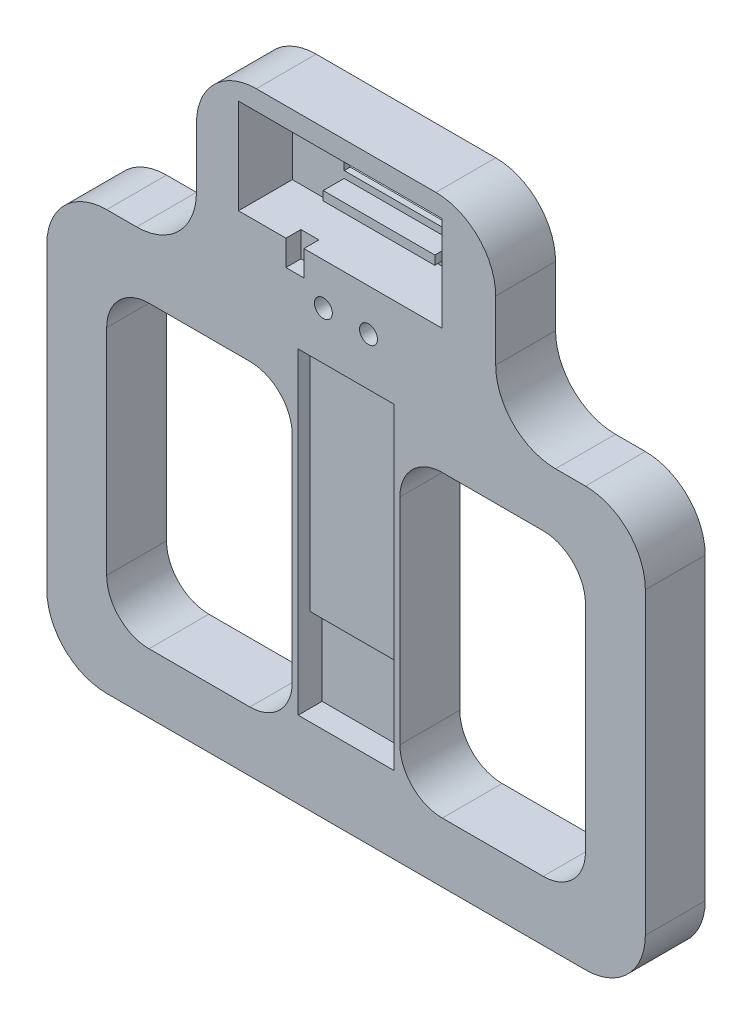
from build123d import *

# Parameters (mm, degrees)
IZIM1_W                      = 200
IZIM1_H                      = 230
Y_KSEKLIK_EKSTR_ZYON1_DEPTH  = 20
KES_EKSTR_ZYON11_DEPTH       = 75
IZIM4_W                      = 100
IZIM4_H                      = 230
KES_EKSTR_ZYON12_DEPTH       = 90
IZIM10_W                     = 32
IZIM10_H                     = 136
Y_KSEKLIK_EKSTR_ZYON6_DEPTH  = 20
KES_EKSTR_ZYON15_DEPTH       = 222
KES_EKSTR_ZYON15_DEPTH_BACK  = 26
Y_KSEKLIK_EKSTR_ZYON7_DEPTH  = 20
IZIM16_W                     = 37.3
IZIM16_H                     = 17
KES_EKSTR_ZYON16_DEPTH       = 20
KES_EKSTR_ZYON20_DEPTH       = 42
KES_EKSTR_ZYON21_DEPTH       = 42
IZIM20_W                     = 71.9
IZIM20_H                     = 2
KES_EKSTR_ZYON22_DEPTH       = 42
IZIM21_R                     = 1.5
Y_KSEKLIK_EKSTR_ZYON8_DEPTH  = 15
IZIM22_W                     = 3
IZIM22_H                     = 3
Y_KSEKLIK_EKSTR_ZYON9_DEPTH  = 8
IZIM23_W                     = 71.9
IZIM23_H                     = 36
Y_KSEKLIK_EKSTR_ZYON10_DEPTH = 1
KES_EKSTR_ZYON23_DEPTH       = 56
KES_EKSTR_ZYON23_DEPTH_BACK  = 86
IZIM24_W                     = 37.3
IZIM24_H                     = 17
IZIM26_W                     = 3
IZIM26_H                     = 3
Y_KSEKLIK_EKSTR_ZYON11_DEPTH = 8
IZIM27_W                     = 71.9
IZIM27_H                     = 2.056938391
Y_KSEKLIK_EKSTR_ZYON13_DEPTH = 19
Y_KSEKLIK_EKSTR_ZYON16_DEPTH = 19
IZIM31_W                     = 3
IZIM31_H                     = 3
Y_KSEKLIK_EKSTR_ZYON18_DEPTH = 8
IZIM32_R                     = 1.5
KES_EKSTR_ZYON24_DEPTH       = 32
IZIM33_R                     = 1.5
Y_KSEKLIK_EKSTR_ZYON19_DEPTH = 12
KES_EKSTR_ZYON27_DEPTH       = 1
KES_EKSTR_ZYON27_DEPTH_BACK  = 3
IZIM37_R                     = 2.5
KES_EKSTR_ZYON28_DEPTH       = 33
IZIM38_W                     = 34
IZIM38_H                     = 110
KES_EKSTR_ZYON33_DEPTH       = 42
IZIM40_W                     = 34
IZIM40_H                     = 110
Y_KSEKLIK_EKSTR_ZYON21_DEPTH = 15
IZIM41_W                     = 4
IZIM41_H                     = 8.5
KES_EKSTR_ZYON35_DEPTH       = 21
IZIM44_W                     = 4
IZIM44_H                     = 8.5
Y_KSEKLIK_EKSTR_ZYON23_DEPTH = 14
IZIM45_W                     = 1
IZIM45_H                     = 110
Y_KSEKLIK_EKSTR_ZYON25_DEPTH = 19
IZIM46_W                     = 12.0691428
IZIM46_H                     = 4.443061609
IZIM46_W_2                   = 12.8
Y_KSEKLIK_EKSTR_ZYON27_DEPTH = 8
IZIM47_W                     = 37.3
IZIM47_H                     = 3
Y_KSEKLIK_EKSTR_ZYON28_DEPTH = 8
KES_EKSTR_ZYON36_DEPTH       = 10
KES_EKSTR_ZYON36_DEPTH_BACK  = 38
IZIM48_W                     = 201.789222688
IZIM48_H                     = 30
KES_EKSTR_ZYON37_DEPTH       = 38
KES_EKSTR_ZYON37_DEPTH_BACK  = 38
KES_EKSTR_ZYON38_DEPTH       = 38
KES_EKSTR_ZYON38_DEPTH_BACK  = 38
SKETCH1_W                    = 32
SKETCH1_H                    = 28
CUT_EXTRUDE1_DEPTH           = 55
SKETCH2_W                    = 32
SKETCH2_H                    = 28
BOSS_EXTRUDE1_DEPTH          = 11
SKETCH3_W                    = 32
SKETCH3_H                    = 4
BOSS_EXTRUDE2_DEPTH          = 19
SKETCH4_W                    = 37.3
SKETCH4_H                    = 0.358806935
CUT_EXTRUDE3_DEPTH           = 11
SKETCH5_W                    = 37.3
SKETCH5_H                    = 0.35880693
BOSS_EXTRUDE3_DEPTH          = 9
SKETCH6_W                    = 37.3
SKETCH6_H                    = 0.358806935
BOSS_EXTRUDE4_DEPTH          = 2
SKETCH7_W                    = 6
SKETCH7_H                    = 8.5
CUT_EXTRUDE4_DEPTH           = 20
SKETCH8_W                    = 6
SKETCH8_H                    = 8.5
BOSS_EXTRUDE5_DEPTH          = 15
SKETCH9_R                    = 3
CUT_EXTRUDE5_DEPTH           = 27
SKETCH10_W                   = 12.0691428
SKETCH10_H                   = 4.443061609
CUT_EXTRUDE8_DEPTH           = 20
SKETCH11_W                   = 12.8
SKETCH11_H                   = 4.443061609
CUT_EXTRUDE9_DEPTH           = 22
SKETCH12_W                   = 12.0691428
SKETCH12_H                   = 4.443061609
SKETCH12_W_2                 = 12.8
BOSS_EXTRUDE6_DEPTH          = 9
CUT_EXTRUDE10_DEPTH          = 37
SKETCH14_R                   = 5
CUT_EXTRUDE11_DEPTH          = 5


with BuildPart() as part:
    # Çizim1 → Yükseklik-Ekstrüzyon1 (new body)
    with BuildSketch(Plane.XY):
        with Locations((54.847725907, 89.085138461)):
            Rectangle(IZIM1_W, IZIM1_H)
    extrude(amount=Y_KSEKLIK_EKSTR_ZYON1_DEPTH)

    # Çizim2 → Kes-Ekstrüzyon11 (cut)
    with BuildSketch(Plane.XY):
        with BuildLine():
            Line((4.847725907, 164.085138461), (4.847725907, 184.085138461))
            ThreePointArc((4.847725907, 184.085138461), (10.705590284, 198.227274085), (24.847725907, 204.085138461))
            Line((24.847725907, 204.085138461), (-45.152274093, 204.085138461))
            Line((-45.152274093, 204.085138461), (-45.152274093, 124.085138461))
            ThreePointArc((-45.152274093, 124.085138461), (-39.294409716, 138.227274085), (-25.152274093, 144.085138461))
            Line((-25.152274093, 144.085138461), (-15.152274093, 144.085138461))
            ThreePointArc((-15.152274093, 144.085138461), (-1.010138469, 149.943002837), (4.847725907, 164.085138461))
        make_face()
        with BuildLine():
            Line((-45.152274093, -25.914861539), (-25.152274093, -25.914861539))
            ThreePointArc((-25.152274093, -25.914861539), (-39.294409716, -20.056997163), (-45.152274093, -5.914861539))
            Line((-45.152274093, -5.914861539), (-45.152274093, -25.914861539))
        make_face()
    extrude(amount=KES_EKSTR_ZYON11_DEPTH, mode=Mode.SUBTRACT)

    # Çizim4 → Kes-Ekstrüzyon12 (cut)
    with BuildSketch(Plane.XY):
        with Locations((104.847725907, 89.085138461)):
            Rectangle(IZIM4_W, IZIM4_H)
    extrude(amount=KES_EKSTR_ZYON12_DEPTH, mode=Mode.SUBTRACT)

    # Aynalama35: part across plane


with BuildPart() as part_1:
    add(part.part)
    add(part.part.mirror(Plane(origin=(54.847725907, 0, 90), x_dir=(0, 0, 1), z_dir=(-1, 0, 0))))

    # Çizim10 → Yükseklik-Ekstrüzyon6 (add)
    with BuildSketch(Plane.XY):
        Polygon((38.847725907, 129.085138461), (72.847725907, 129.085138461), (72.847725907, -10.914861539), (36.847725907, -10.914861539), (36.847725907, 129.085138461), align=None)
        with Locations((54.847725907, 59.085138461)):
            Rectangle(IZIM10_W, IZIM10_H, mode=Mode.SUBTRACT)
    extrude(amount=-Y_KSEKLIK_EKSTR_ZYON6_DEPTH)

    # Çizim11 → Kes-Ekstrüzyon15 (cut, two sides: drawn at the far end of the back side and taken through both)
    with BuildSketch(Plane(origin=(0, 0, 0), x_dir=(0, 0, -1), z_dir=(1, 0, 0)).offset(-KES_EKSTR_ZYON15_DEPTH_BACK)):
        Polygon((20, -10.914861539), (14, -10.914861539), (20, 129.085138461), align=None)
    extrude(amount=KES_EKSTR_ZYON15_DEPTH + KES_EKSTR_ZYON15_DEPTH_BACK, mode=Mode.SUBTRACT)

    # Çizim15 → Yükseklik-Ekstrüzyon7 (add)
    with BuildSketch(Plane.XY):
        with BuildLine():
            Line((-45.152274093, 124.085138461), (-45.152274093, -5.914861539))
            ThreePointArc((-45.152274093, -5.914861539), (-39.294409716, -20.056997163), (-25.152274093, -25.914861539))
            Line((-25.152274093, -25.914861539), (134.847725907, -25.914861539))
            ThreePointArc((134.847725907, -25.914861539), (148.989861531, -20.056997163), (154.847725907, -5.914861539))
            Line((154.847725907, -5.914861539), (154.847725907, 124.085138461))
            ThreePointArc((154.847725907, 124.085138461), (148.989861531, 138.227274085), (134.847725907, 144.085138461))
            Line((134.847725907, 144.085138461), (124.847725907, 144.085138461))
            ThreePointArc((124.847725907, 144.085138461), (110.705590284, 149.943002837), (104.847725907, 164.085138461))
            Line((104.847725907, 164.085138461), (104.847725907, 184.085138461))
            ThreePointArc((104.847725907, 184.085138461), (98.989861531, 198.227274085), (84.847725907, 204.085138461))
            Line((84.847725907, 204.085138461), (24.847725907, 204.085138461))
            ThreePointArc((24.847725907, 204.085138461), (10.705590284, 198.227274085), (4.847725907, 184.085138461))
            Line((4.847725907, 184.085138461), (4.847725907, 164.085138461))
            ThreePointArc((4.847725907, 164.085138461), (-1.010138469, 149.943002837), (-15.152274093, 144.085138461))
            Line((-15.152274093, 144.085138461), (-25.152274093, 144.085138461))
            ThreePointArc((-25.152274093, 144.085138461), (-39.294409716, 138.227274085), (-45.152274093, 124.085138461))
        make_face()
    extrude(amount=Y_KSEKLIK_EKSTR_ZYON7_DEPTH)

    # Çizim16 → Kes-Ekstrüzyon16 (cut)
    with BuildSketch(Plane.XY):
        with Locations((54.847725907, 185.585138461)):
            Rectangle(IZIM16_W, IZIM16_H)
    extrude(amount=KES_EKSTR_ZYON16_DEPTH, mode=Mode.SUBTRACT)

    # Çizim18 → Kes-Ekstrüzyon20 (cut)
    with BuildSketch(Plane(origin=(0, 0, 1), x_dir=(-1, 0, 0), z_dir=(0, 0, -1))):
        Polygon((-90.797725907, 197.585138461), (-90.797725907, 185.585138461), (-90.797725907, 163.585138461), (-18.897725907, 163.585138461), (-18.897725907, 197.585138461), align=None)
    extrude(amount=-KES_EKSTR_ZYON20_DEPTH, mode=Mode.SUBTRACT)

    # Çizim19 → Kes-Ekstrüzyon21 (cut)
    with BuildSketch(Plane(origin=(72.847725907, 0, 0), x_dir=(0, 0, -1), z_dir=(1, 0, 0))):
        Polygon((0, 129.085138461), (20, 129.085138461), (14, -10.914861539), (0, -10.914861539), align=None)
    extrude(amount=-KES_EKSTR_ZYON21_DEPTH, mode=Mode.SUBTRACT)

    # Çizim20 → Kes-Ekstrüzyon22 (cut)
    with BuildSketch(Plane(origin=(0, 0, 1), x_dir=(-1, 0, 0), z_dir=(0, 0, -1))):
        with Locations((-54.847725907, 198.585138461)):
            Rectangle(IZIM20_W, IZIM20_H)
    extrude(amount=-KES_EKSTR_ZYON22_DEPTH, mode=Mode.SUBTRACT)

    # Çizim21 → Yükseklik-Ekstrüzyon8 (add)
    with BuildSketch(Plane.XY.offset(1)):
        with Locations((27.697725907, 194.585138461)):
            Circle(IZIM21_R)
        with Locations((75.597725907, 194.585138461)):
            Circle(IZIM21_R)
    extrude(amount=Y_KSEKLIK_EKSTR_ZYON8_DEPTH)

    # Çizim22 → Yükseklik-Ekstrüzyon9 (add)
    with BuildSketch(Plane(origin=(0, 0, 1), x_dir=(-1, 0, 0), z_dir=(0, 0, -1))):
        with Locations((-71.997725907, 172.926331526)):
            Rectangle(IZIM22_W, IZIM22_H)
        with Locations((-37.697725907, 172.926331526)):
            Rectangle(IZIM22_W, IZIM22_H)
    extrude(amount=-Y_KSEKLIK_EKSTR_ZYON9_DEPTH)

    # Çizim23 → Yükseklik-Ekstrüzyon10 (add)
    with BuildSketch(Plane(origin=(0, 0, 1), x_dir=(-1, 0, 0), z_dir=(0, 0, -1))):
        with Locations((-54.847725907, 181.585138461)):
            Rectangle(IZIM23_W, IZIM23_H)
    extrude(amount=-Y_KSEKLIK_EKSTR_ZYON10_DEPTH)

    # Çizim24 → Kes-Ekstrüzyon23 (cut, two sides: drawn at the far end of the back side and taken through both)
    with BuildSketch(Plane(origin=(0, 0, 1), x_dir=(-1, 0, 0), z_dir=(0, 0, -1)).offset(-KES_EKSTR_ZYON23_DEPTH_BACK)):
        with Locations((-54.847725907, 185.585138461)):
            Rectangle(IZIM24_W, IZIM24_H)
    extrude(amount=KES_EKSTR_ZYON23_DEPTH + KES_EKSTR_ZYON23_DEPTH_BACK, mode=Mode.SUBTRACT)

    # Çizim26 → Yükseklik-Ekstrüzyon11 (add)
    with BuildSketch(Plane(origin=(0, 0, 1), x_dir=(-1, 0, 0), z_dir=(0, 0, -1))):
        with Locations((-37.697725907, 172.926331526)):
            Rectangle(IZIM26_W, IZIM26_H)
    extrude(amount=-Y_KSEKLIK_EKSTR_ZYON11_DEPTH)

    # Çizim27 → Yükseklik-Ekstrüzyon13 (add)
    with BuildSketch(Plane(origin=(0, 0, 1), x_dir=(-1, 0, 0), z_dir=(0, 0, -1))):
        with Locations((-54.847725907, 198.556669266)):
            Rectangle(IZIM27_W, IZIM27_H)
    extrude(amount=-Y_KSEKLIK_EKSTR_ZYON13_DEPTH)

    # Çizim29 → Yükseklik-Ekstrüzyon16 (add)
    with BuildSketch(Plane(origin=(0, 0, 1), x_dir=(-1, 0, 0), z_dir=(0, 0, -1))):
        Polygon((-18.897725907, 163.585138461), (-18.897725907, 165.785138461), (-86.897725907, 165.785138461), (-86.897725907, 197.52820007), (-90.797725907, 197.52820007), (-90.797725907, 163.585138461), align=None)
    extrude(amount=-Y_KSEKLIK_EKSTR_ZYON16_DEPTH)

    # Çizim31 → Yükseklik-Ekstrüzyon18 (add)
    with BuildSketch(Plane(origin=(0, 0, 1), x_dir=(-1, 0, 0), z_dir=(0, 0, -1))):
        with Locations((-37.697725907, 172.926331526)):
            Rectangle(IZIM31_W, IZIM31_H)
        with Locations((-71.997725907, 172.926331526)):
            Rectangle(IZIM31_W, IZIM31_H)
    extrude(amount=-Y_KSEKLIK_EKSTR_ZYON18_DEPTH)

    # Çizim32 → Kes-Ekstrüzyon24 (cut)
    with BuildSketch(Plane(origin=(0, 0, 1), x_dir=(-1, 0, 0), z_dir=(0, 0, -1))):
        with Locations((-27.697725907, 194.585138461)):
            Circle(IZIM32_R)
        with Locations((-75.597725907, 194.585138461)):
            Circle(IZIM32_R)
    extrude(amount=-KES_EKSTR_ZYON24_DEPTH, mode=Mode.SUBTRACT)

    # Çizim33 → Yükseklik-Ekstrüzyon19 (add)
    with BuildSketch(Plane(origin=(0, 0, 1), x_dir=(-1, 0, 0), z_dir=(0, 0, -1))):
        with Locations((-27.697725907, 194.585138461)):
            Circle(IZIM33_R)
        with Locations((-75.597725907, 194.585138461)):
            Circle(IZIM33_R)
    extrude(amount=-Y_KSEKLIK_EKSTR_ZYON19_DEPTH)

    # Çizim34 → Kes-Ekstrüzyon27 (cut, two sides: drawn at the far end of the back side and taken through both)
    with BuildSketch(Plane(origin=(0, 0, 1), x_dir=(-1, 0, 0), z_dir=(0, 0, -1)).offset(-KES_EKSTR_ZYON27_DEPTH_BACK)):
        Polygon((-50.869562549, 153.785138461), (-51.995395574, 151.835138461), (-49.628259471, 147.735138461), (-44.893987263, 147.735138461), (-42.52685116, 151.835138461), (-44.893987263, 155.935138461), (-49.628259471, 155.935138461), align=None)
        Polygon((-64.714862011, 155.885138461), (-67.081998115, 151.785138461), (-64.714862011, 147.685138461), (-59.980589804, 147.685138461), (-57.6134537, 151.785138461), (-58.768154238, 153.785138461), (-59.980589804, 155.885138461), align=None)
    extrude(amount=KES_EKSTR_ZYON27_DEPTH + KES_EKSTR_ZYON27_DEPTH_BACK, mode=Mode.SUBTRACT)

    # Çizim37 → Kes-Ekstrüzyon28 (cut)
    with BuildSketch(Plane(origin=(0, 0, 1), x_dir=(-1, 0, 0), z_dir=(0, 0, -1))):
        with Locations((-62.347725907, 151.785138461)):
            Circle(IZIM37_R)
        with Locations((-47.261123367, 151.785138461)):
            Circle(IZIM37_R)
    extrude(amount=-KES_EKSTR_ZYON28_DEPTH, mode=Mode.SUBTRACT)

    # Çizim38 → Kes-Ekstrüzyon33 (cut)
    with BuildSketch(Plane(origin=(0, 0, 1), x_dir=(-1, 0, 0), z_dir=(0, 0, -1))):
        with Locations((-54.847725907, 84.785138461)):
            Rectangle(IZIM38_W, IZIM38_H)
    extrude(amount=-KES_EKSTR_ZYON33_DEPTH, mode=Mode.SUBTRACT)

    # Çizim40 → Yükseklik-Ekstrüzyon21 (add)
    with BuildSketch(Plane(origin=(0, 0, 1), x_dir=(-1, 0, 0), z_dir=(0, 0, -1))):
        with Locations((-54.847725907, 84.785138461)):
            Rectangle(IZIM40_W, IZIM40_H)
    extrude(amount=-Y_KSEKLIK_EKSTR_ZYON21_DEPTH)

    # Çizim41 → Kes-Ekstrüzyon35 (cut)
    with BuildSketch(Plane(origin=(0, 0, 1), x_dir=(-1, 0, 0), z_dir=(0, 0, -1))):
        with Locations((-37.761123367, 161.535138461)):
            Rectangle(IZIM41_W, IZIM41_H)
    extrude(amount=-KES_EKSTR_ZYON35_DEPTH, mode=Mode.SUBTRACT)

    # Çizim44 → Yükseklik-Ekstrüzyon23 (add)
    with BuildSketch(Plane(origin=(0, 0, 1), x_dir=(-1, 0, 0), z_dir=(0, 0, -1))):
        with Locations((-37.761123367, 161.535138461)):
            Rectangle(IZIM44_W, IZIM44_H)
    extrude(amount=-Y_KSEKLIK_EKSTR_ZYON23_DEPTH)

    # Çizim45 → Yükseklik-Ekstrüzyon25 (add)
    with BuildSketch(Plane(origin=(0, 0, 1), x_dir=(-1, 0, 0), z_dir=(0, 0, -1))):
        with Locations((-38.347725907, 84.785138461)):
            Rectangle(IZIM45_W, IZIM45_H)
        with Locations((-71.347725907, 84.785138461)):
            Rectangle(IZIM45_W, IZIM45_H)
    extrude(amount=-Y_KSEKLIK_EKSTR_ZYON25_DEPTH)

    # Çizim46 → Yükseklik-Ekstrüzyon27 (add)
    with BuildSketch(Plane(origin=(0, 0, 1), x_dir=(-1, 0, 0), z_dir=(0, 0, -1))):
        with Locations((-24.932297307, 195.306669266)):
            Rectangle(IZIM46_W, IZIM46_H)
        with Locations((-80.497725907, 195.306669266)):
            Rectangle(IZIM46_W_2, IZIM46_H)
    extrude(amount=-Y_KSEKLIK_EKSTR_ZYON27_DEPTH)

    # Çizim47 → Yükseklik-Ekstrüzyon28 (add)
    with BuildSketch(Plane(origin=(0, 0, 1), x_dir=(-1, 0, 0), z_dir=(0, 0, -1))):
        with Locations((-54.847725907, 172.926331526)):
            Rectangle(IZIM47_W, IZIM47_H)
    extrude(amount=-Y_KSEKLIK_EKSTR_ZYON28_DEPTH)

    # Çizim48 → Kes-Ekstrüzyon36 (cut, two sides: drawn at the far end of the back side and taken through both)
    with BuildSketch(Plane(origin=(0, 0, 1), x_dir=(-1, 0, 0), z_dir=(0, 0, -1)).offset(-KES_EKSTR_ZYON36_DEPTH_BACK)):
        with Locations((-53.953114563, -10.914861539)):
            Rectangle(IZIM48_W, IZIM48_H)
    extrude(amount=KES_EKSTR_ZYON36_DEPTH + KES_EKSTR_ZYON36_DEPTH_BACK, mode=Mode.SUBTRACT)

    # Çizim49 → Kes-Ekstrüzyon37 (cut, two sides: drawn at the far end of the back side and taken through both)
    with BuildSketch(Plane(origin=(0, 0, 1), x_dir=(-1, 0, 0), z_dir=(0, 0, -1)).offset(-KES_EKSTR_ZYON37_DEPTH_BACK)):
        with BuildLine():
            Line((-154.847725907, 4.085138461), (-134.847725907, 4.085138461))
            ThreePointArc((-134.847725907, 4.085138461), (-148.989861531, 9.943002837), (-154.847725907, 24.085138461))
            Line((-154.847725907, 24.085138461), (-154.847725907, 4.085138461))
        make_face()
    extrude(amount=KES_EKSTR_ZYON37_DEPTH + KES_EKSTR_ZYON37_DEPTH_BACK, mode=Mode.SUBTRACT)

    # Çizim50 → Kes-Ekstrüzyon38 (cut, two sides: drawn at the far end of the back side and taken through both)
    with BuildSketch(Plane(origin=(0, 0, 1), x_dir=(-1, 0, 0), z_dir=(0, 0, -1)).offset(-KES_EKSTR_ZYON38_DEPTH_BACK)):
        with BuildLine():
            Line((45.152274093, 4.085138461), (25.152274093, 4.085138461))
            ThreePointArc((25.152274093, 4.085138461), (39.294409716, 9.943002837), (45.152274093, 24.085138461))
            Line((45.152274093, 24.085138461), (45.152274093, 4.085138461))
        make_face()
    extrude(amount=KES_EKSTR_ZYON38_DEPTH + KES_EKSTR_ZYON38_DEPTH_BACK, mode=Mode.SUBTRACT)

    # Sketch1 → Cut-Extrude1 (cut)
    with BuildSketch(Plane(origin=(0, 0, 1), x_dir=(-1, 0, 0), z_dir=(0, 0, -1))):
        with Locations((-54.847725907, 43.785138461)):
            Rectangle(SKETCH1_W, SKETCH1_H)
    extrude(amount=-CUT_EXTRUDE1_DEPTH, mode=Mode.SUBTRACT)

    # Sketch2 → Boss-Extrude1 (add)
    with BuildSketch(Plane(origin=(0, 0, 1), x_dir=(-1, 0, 0), z_dir=(0, 0, -1))):
        with Locations((-54.847725907, 43.785138461)):
            Rectangle(SKETCH2_W, SKETCH2_H)
    extrude(amount=-BOSS_EXTRUDE1_DEPTH)

    # Sketch3 → Boss-Extrude2 (add)
    with BuildSketch(Plane(origin=(0, 0, 1), x_dir=(-1, 0, 0), z_dir=(0, 0, -1))):
        with Locations((-54.847725907, 137.785138461)):
            Rectangle(SKETCH3_W, SKETCH3_H)
    extrude(amount=-BOSS_EXTRUDE2_DEPTH)

    # Sketch4 → Cut-Extrude3 (cut)
    with BuildSketch(Plane.XY):
        with Locations((54.847725907, 171.605734993)):
            Rectangle(SKETCH4_W, SKETCH4_H)
    extrude(amount=CUT_EXTRUDE3_DEPTH, mode=Mode.SUBTRACT)

    # Sketch5 → Boss-Extrude3 (add)
    with BuildSketch(Plane.XY):
        with Locations((54.847725907, 174.605734991)):
            Rectangle(SKETCH5_W, SKETCH5_H)
    extrude(amount=BOSS_EXTRUDE3_DEPTH)

    # Sketch6 → Boss-Extrude4 (add)
    with BuildSketch(Plane.XY):
        with Locations((54.847725907, 171.605734993)):
            Rectangle(SKETCH6_W, SKETCH6_H)
    extrude(amount=BOSS_EXTRUDE4_DEPTH)

    # Sketch7 → Cut-Extrude4 (cut)
    with BuildSketch(Plane.XY):
        with Locations((37.761123367, 161.535138461)):
            Rectangle(SKETCH7_W, SKETCH7_H)
    extrude(amount=CUT_EXTRUDE4_DEPTH, mode=Mode.SUBTRACT)

    # Sketch8 → Boss-Extrude5 (add)
    with BuildSketch(Plane.XY):
        with Locations((37.761123367, 161.535138461)):
            Rectangle(SKETCH8_W, SKETCH8_H)
    extrude(amount=BOSS_EXTRUDE5_DEPTH)

    # Sketch9 → Cut-Extrude5 (cut)
    with BuildSketch(Plane.XY):
        with Locations((62.347725907, 151.785138461)):
            Circle(SKETCH9_R)
        with Locations((47.261123367, 151.785138461)):
            Circle(SKETCH9_R)
    extrude(amount=CUT_EXTRUDE5_DEPTH, mode=Mode.SUBTRACT)

    # Sketch10 → Cut-Extrude8 (cut)
    with BuildSketch(Plane.XY):
        with Locations((24.932297307, 195.306669266)):
            Rectangle(SKETCH10_W, SKETCH10_H)
    extrude(amount=CUT_EXTRUDE8_DEPTH, mode=Mode.SUBTRACT)

    # Sketch11 → Cut-Extrude9 (cut)
    with BuildSketch(Plane.XY):
        with Locations((80.497725907, 195.306669266)):
            Rectangle(SKETCH11_W, SKETCH11_H)
    extrude(amount=CUT_EXTRUDE9_DEPTH, mode=Mode.SUBTRACT)

    # Sketch12 → Boss-Extrude6 (add)
    with BuildSketch(Plane.XY):
        with Locations((24.932297307, 195.306669266)):
            Rectangle(SKETCH12_W, SKETCH12_H)
        with Locations((80.497725907, 195.306669266)):
            Rectangle(SKETCH12_W_2, SKETCH12_H)
    extrude(amount=BOSS_EXTRUDE6_DEPTH)

    # Sketch13 → Cut-Extrude10 (cut)
    with BuildSketch(Plane.XY):
        with BuildLine():
            Line((-25.152274089, 109.943002837), (-25.152274089, 38.227274077))
            ThreePointArc((-25.152274089, 38.227274077), (-21.010138466, 28.22727408), (-11.010138469, 24.085138457))
            Line((-11.010138469, 24.085138457), (22.705590287, 24.085138457))
            ThreePointArc((22.705590287, 24.085138457), (32.705590285, 28.22727408), (36.847725907, 38.227274077))
            Line((36.847725907, 38.227274077), (36.847725907, 109.943002837))
            ThreePointArc((36.847725907, 109.943002837), (32.705590285, 119.943002835), (22.705590287, 124.085138457))
            Line((22.705590287, 124.085138457), (-11.010138469, 124.085138457))
            ThreePointArc((-11.010138469, 124.085138457), (-21.010138466, 119.943002835), (-25.152274089, 109.943002837))
        make_face()
        with BuildLine():
            Line((120.705590284, 24.085138457), (86.989861527, 24.085138457))
            ThreePointArc((86.989861527, 24.085138457), (76.98986153, 28.22727408), (72.847725907, 38.227274077))
            Line((72.847725907, 38.227274077), (72.847725907, 109.943002837))
            ThreePointArc((72.847725907, 109.943002837), (76.98986153, 119.943002835), (86.989861527, 124.085138457))
            Line((86.989861527, 124.085138457), (120.705590284, 124.085138457))
            ThreePointArc((120.705590284, 124.085138457), (130.705590281, 119.943002835), (134.847725904, 109.943002837))
            Line((134.847725904, 109.943002837), (134.847725904, 38.227274077))
            ThreePointArc((134.847725904, 38.227274077), (130.705590281, 28.22727408), (120.705590284, 24.085138457))
        make_face()
    extrude(amount=CUT_EXTRUDE10_DEPTH, mode=Mode.SUBTRACT)

    # Sketch14 → Cut-Extrude11 (cut)
    with BuildSketch(Plane.XY):
        with Locations((47.261123367, 151.785138461)):
            Circle(SKETCH14_R)
        with Locations((62.347725907, 151.785138461)):
            Circle(SKETCH14_R)
    extrude(amount=CUT_EXTRUDE11_DEPTH, mode=Mode.SUBTRACT)


solid = part_1.part
